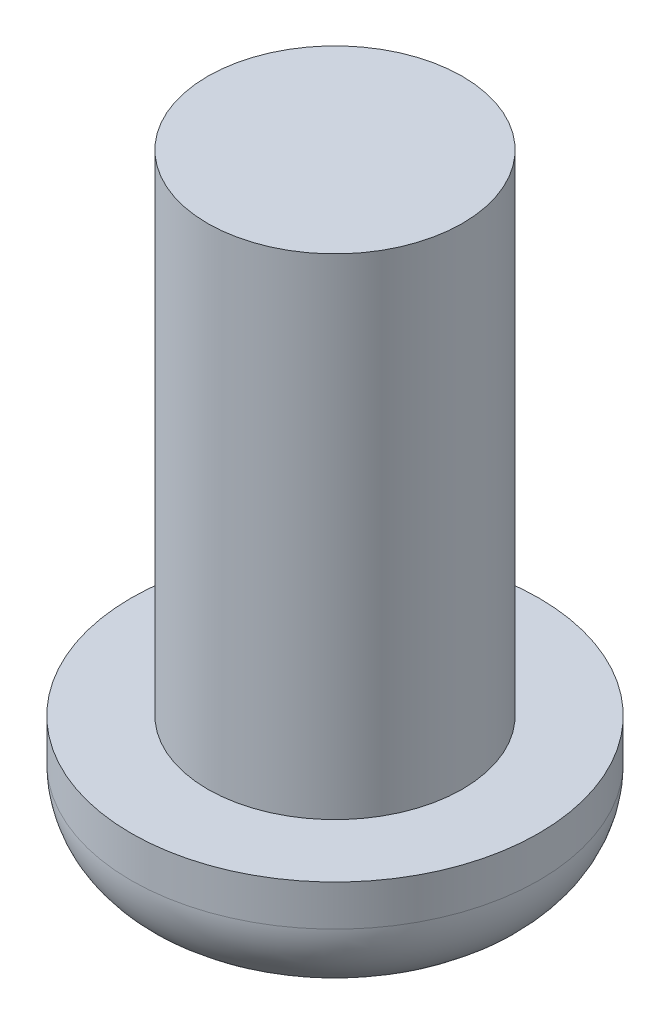
from build123d import *

# Parameters (mm, degrees)
SKETCH1_R           = 2.4765
BOSS_EXTRUDE1_DEPTH = 9.525
SKETCH2_R           = 3.9624
BOSS_EXTRUDE2_DEPTH = 2.38125
CUT_EXTRUDE1_DEPTH  = 2.286
FILLET1_R           = 1.5875


with BuildPart() as part:
    # Sketch1 → Boss-Extrude1 (new body)
    with BuildSketch(Plane(origin=(0, 0, 0), x_dir=(1, 0, 0), z_dir=(0, 1, 0))):
        with Locations(Location((0, 0, 0), (0, 0, 90))):
            Circle(SKETCH1_R)
    extrude(amount=BOSS_EXTRUDE1_DEPTH)

    # Sketch2 → Boss-Extrude2 (add)
    with BuildSketch(Plane.XZ):
        with Locations(Location((0, 0, 0), (0, 0, 90))):
            Circle(SKETCH2_R)
    extrude(amount=BOSS_EXTRUDE2_DEPTH)

    # Sketch3 → Cut-Extrude1 (cut)
    with BuildSketch(Plane.XZ.offset(2.38125)):
        Polygon((2.062222993, 0), (1.031111496, 1.7859375), (-1.031111496, 1.7859375), (-2.062222993, 0), (-1.031111496, -1.7859375), (1.031111496, -1.7859375), align=None)
    extrude(amount=-CUT_EXTRUDE1_DEPTH, mode=Mode.SUBTRACT)

    # Fillet1
    fillet1_edges = [part.edges().sort_by_distance(p)[0] for p in [
        (0, -2.38125, -3.9624),
    ]]
    fillet(fillet1_edges, radius=FILLET1_R)


solid = part.part
